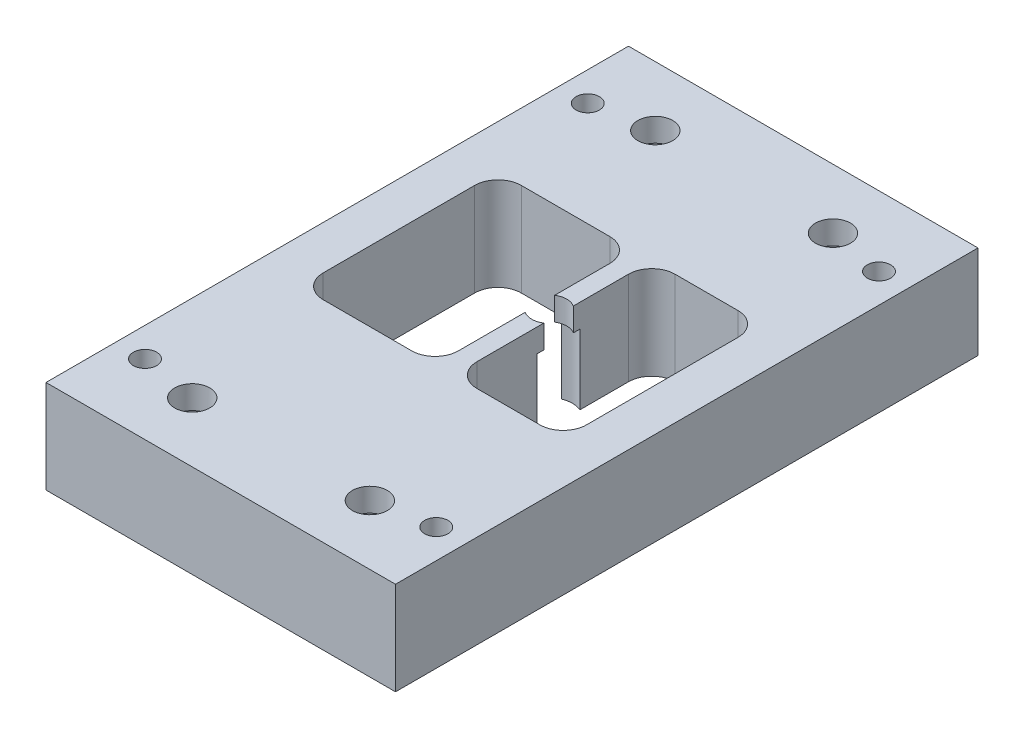
from build123d import *

# Parameters (mm, degrees)
SKETCH1_W              = 150
SKETCH1_H              = 250
BOSS_EXTRUDE1_DEPTH    = 40
CUT_EXTRUDE1_REACH     = 153.162
SKETCH3_W              = 58
SKETCH3_H              = 85
SKETCH3_W_2            = 47
FILLET1_R              = 10
SKETCH7_R              = 7.5
CUT_EXTRUDE4_DEPTH     = 369.774778015
SKETCH8_R              = 10
CUT_EXTRUDE5_DEPTH     = 30
M10_TAPPED_HOLE1_D     = 8.5
M10_TAPPED_HOLE1_DEPTH = 24.5
M10_TAPPED_HOLE1_TIP   = 2.553657631
F_10_0MM_DOWEL_HOLE1_D = 10
CUT_EXTRUDE6_REACH     = 153.162
SKETCH15_R             = 7.5
SKETCH16_R             = 9
CUT_EXTRUDE7_DEPTH     = 30


with BuildPart() as part:
    # Sketch1 → Boss-Extrude1 (new body)
    with BuildSketch(Plane(origin=(0, 0, 0), x_dir=(1, 0, 0), z_dir=(0, 1, 0))):
        Rectangle(SKETCH1_W, SKETCH1_H)
    extrude(amount=-BOSS_EXTRUDE1_DEPTH)

    # Sketch3 → Cut-Extrude1 (cut, up to next)
    with BuildSketch(Plane(origin=(0, 0, 0), x_dir=(1, 0, 0), z_dir=(0, 1, 0)), mode=Mode.PRIVATE) as cut_extrude1_sk1:
        with Locations((-27.25, 7.73)):
            Rectangle(SKETCH3_W, SKETCH3_H)
    cut_extrude1_tool1 = extrude(cut_extrude1_sk1.sketch, amount=-CUT_EXTRUDE1_REACH, mode=Mode.PRIVATE) & part.part
    # Sketch3 → Cut-Extrude1 (cut, up to next)
    with BuildSketch(Plane(origin=(0, 0, 0), x_dir=(1, 0, 0), z_dir=(0, 1, 0)), mode=Mode.PRIVATE) as cut_extrude1_sk2:
        with Locations((33.25, 7.73)):
            Rectangle(SKETCH3_W_2, SKETCH3_H)
    cut_extrude1_tool2 = extrude(cut_extrude1_sk2.sketch, amount=-CUT_EXTRUDE1_REACH, mode=Mode.PRIVATE) & part.part
    add(cut_extrude1_tool1.solids().sort_by_distance((-27.25, 0, -7.73))[0], mode=Mode.SUBTRACT)
    add(cut_extrude1_tool2.solids().sort_by_distance((33.25, 0, -7.73))[0], mode=Mode.SUBTRACT)

    # Fillet1
    fillet1_edges = [part.edges().sort_by_distance(p)[0] for p in [
        (-56.25, -20, 34.77),
        (-56.25, -20, -50.23),
        (1.75, -20, -50.23),
        (1.75, -20, 34.77),
        (9.75, -20, 34.77),
        (9.75, -20, -50.23),
        (56.75, -20, -50.23),
        (56.75, -20, 34.77),
    ]]
    fillet(fillet1_edges, radius=FILLET1_R)

    # Sketch7 → Cut-Extrude4 (cut, through all)
    with BuildSketch(Plane(origin=(269.63, 0, 0), x_dir=(1, 0, 0), z_dir=(0, 1, 0))):
        with Locations((-263.88, 10.23)):
            Circle(SKETCH7_R)
    extrude(amount=-CUT_EXTRUDE4_DEPTH, mode=Mode.SUBTRACT)

    # Sketch8 → Cut-Extrude5 (cut)
    with BuildSketch(Plane(origin=(269.63, -40, 0), x_dir=(1, 0, 0), z_dir=(0, -1, 0))):
        with Locations((-263.88, -10.23)):
            Circle(SKETCH8_R)
    extrude(amount=-CUT_EXTRUDE5_DEPTH, mode=Mode.SUBTRACT)

    # M10 Tapped Hole1
    with Locations(Plane(origin=(0, -40, 0), x_dir=(-1, 0, 0), z_dir=(0, -1, 0))):
        with Locations((-62.5, 112.5), (62.5, 112.5), (62.5, -112.5), (-62.5, -112.5)):
            Hole(M10_TAPPED_HOLE1_D / 2, depth=M10_TAPPED_HOLE1_DEPTH)
            with Locations((0, 0, -(M10_TAPPED_HOLE1_DEPTH + M10_TAPPED_HOLE1_TIP / 2))):  # 118° drill point
                Cone(0, M10_TAPPED_HOLE1_D / 2, M10_TAPPED_HOLE1_TIP, mode=Mode.SUBTRACT)

    # Ø10.0mm Dowel Hole1 (through all)
    with Locations(Plane(origin=(0, -40, 0), x_dir=(-1, 0, 0), z_dir=(0, -1, 0))):
        with Locations((-62.5, 95), (-62.5, -95), (62.5, -95), (62.5, 95)):
            Hole(F_10_0MM_DOWEL_HOLE1_D / 2)

    # Sketch15 → Cut-Extrude6 (cut, up to next)
    with BuildSketch(Plane(origin=(0, 0, 0), x_dir=(1, 0, 0), z_dir=(0, 1, 0)), mode=Mode.PRIVATE) as cut_extrude6_sk1:
        with Locations(Location((38.38, -99.376818869, 0), (0, 0, 270))):
            Circle(SKETCH15_R)
    cut_extrude6_tool1 = extrude(cut_extrude6_sk1.sketch, amount=-CUT_EXTRUDE6_REACH, mode=Mode.PRIVATE) & part.part
    # Sketch15 → Cut-Extrude6 (cut, up to next)
    with BuildSketch(Plane(origin=(0, 0, 0), x_dir=(1, 0, 0), z_dir=(0, 1, 0)), mode=Mode.PRIVATE) as cut_extrude6_sk2:
        with Locations(Location((-37.87, -99.370796223, 0), (0, 0, 270))):
            Circle(SKETCH15_R)
    cut_extrude6_tool2 = extrude(cut_extrude6_sk2.sketch, amount=-CUT_EXTRUDE6_REACH, mode=Mode.PRIVATE) & part.part
    # Sketch15 → Cut-Extrude6 (cut, up to next)
    with BuildSketch(Plane(origin=(0, 0, 0), x_dir=(1, 0, 0), z_dir=(0, 1, 0)), mode=Mode.PRIVATE) as cut_extrude6_sk3:
        with Locations(Location((38.38, 99.376818869, 0), (0, 0, 270))):
            Circle(SKETCH15_R)
    cut_extrude6_tool3 = extrude(cut_extrude6_sk3.sketch, amount=-CUT_EXTRUDE6_REACH, mode=Mode.PRIVATE) & part.part
    # Sketch15 → Cut-Extrude6 (cut, up to next)
    with BuildSketch(Plane(origin=(0, 0, 0), x_dir=(1, 0, 0), z_dir=(0, 1, 0)), mode=Mode.PRIVATE) as cut_extrude6_sk4:
        with Locations(Location((-37.87, 99.370796223, 0), (0, 0, 270))):
            Circle(SKETCH15_R)
    cut_extrude6_tool4 = extrude(cut_extrude6_sk4.sketch, amount=-CUT_EXTRUDE6_REACH, mode=Mode.PRIVATE) & part.part
    add(cut_extrude6_tool1.solids().sort_by_distance((38.38, 0, 99.376819))[0], mode=Mode.SUBTRACT)
    add(cut_extrude6_tool2.solids().sort_by_distance((-37.87, 0, 99.370796))[0], mode=Mode.SUBTRACT)
    add(cut_extrude6_tool3.solids().sort_by_distance((38.38, 0, -99.376819))[0], mode=Mode.SUBTRACT)
    add(cut_extrude6_tool4.solids().sort_by_distance((-37.87, 0, -99.370796))[0], mode=Mode.SUBTRACT)

    # Sketch16 → Cut-Extrude7 (cut)
    with BuildSketch(Plane.XZ.offset(40)):
        with Locations(Location((-37.87, -99.370796223, 0), (0, 0, 270))):
            Circle(SKETCH16_R)
        with Locations(Location((38.38, -99.376818869, 0), (0, 0, 270))):
            Circle(SKETCH16_R)
        with Locations(Location((38.38, 99.376818869, 0), (0, 0, 270))):
            Circle(SKETCH16_R)
        with Locations(Location((-37.87, 99.370796223, 0), (0, 0, 270))):
            Circle(SKETCH16_R)
    extrude(amount=-CUT_EXTRUDE7_DEPTH, mode=Mode.SUBTRACT)


solid = part.part
